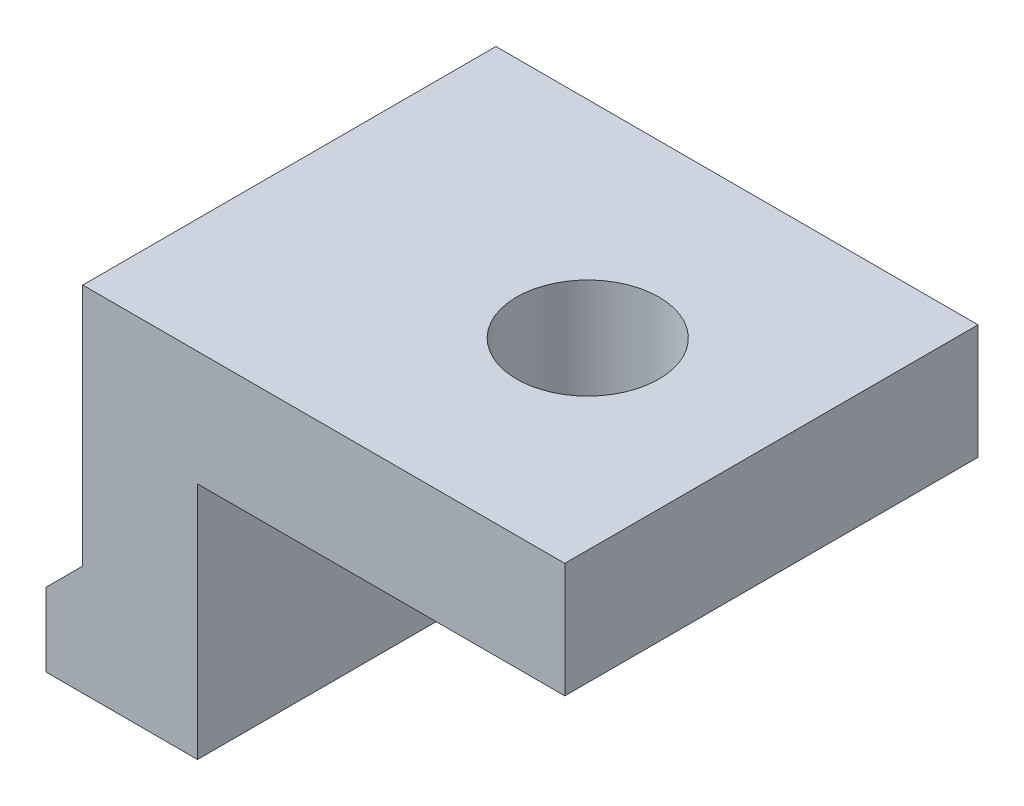
from build123d import *

# Parameters (mm, degrees)
SKETCH1_W           = 8
SKETCH1_H           = 2.5
BOSS_EXTRUDE1_DEPTH = 9
SKETCH2_R           = 1.55
CUT_EXTRUDE1_DEPTH  = 14.116401946


with BuildPart() as part:
    # Sketch1 → Boss-Extrude1 (new body)
    with BuildSketch(Plane.XY):
        with Locations((4, -1.25)):
            Rectangle(SKETCH1_W, SKETCH1_H)
        Polygon((0, -7.7), (0, 0), (-2.5, 0), (-2.5, -5.3), (-3.3, -6.1), (-3.3, -7.7), align=None)
    extrude(amount=BOSS_EXTRUDE1_DEPTH)

    # Sketch2 → Cut-Extrude1 (cut, through all)
    with BuildSketch(Plane.XZ.offset(2.5)):
        with Locations(Location((4, 4.5, 0), (0, 0, 270))):
            Circle(SKETCH2_R)
    extrude(amount=-CUT_EXTRUDE1_DEPTH, mode=Mode.SUBTRACT)


solid = part.part
